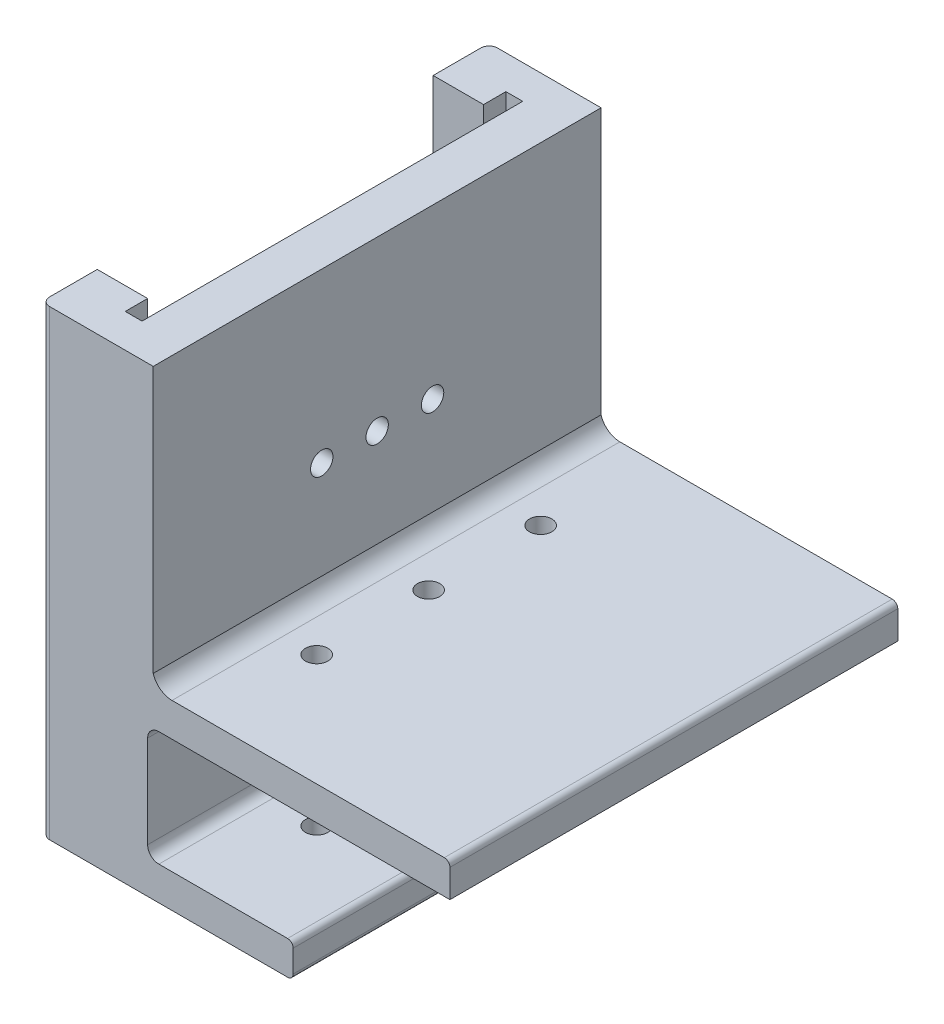
from build123d import *

# Parameters (mm, degrees)
BOSS_EXTRUDE2_DEPTH = 80
SKETCH3_R           = 2
CUT_EXTRUDE2_DEPTH  = 80
SKETCH4_W           = 20
SKETCH4_H           = 80
BOSS_EXTRUDE3_DEPTH = 50
BOSS_EXTRUDE4_DEPTH = 80
SKETCH6_W           = 12
SKETCH6_H           = 60
CUT_EXTRUDE4_DEPTH  = 90
SKETCH7_W           = 3
SKETCH7_H           = 68
CUT_EXTRUDE5_DEPTH  = 90
SKETCH9_R           = 2
CUT_EXTRUDE6_DEPTH  = 90
SKETCH11_R          = 2
CUT_EXTRUDE7_DEPTH  = 90


with BuildPart() as part:
    # Sketch1 → Boss-Extrude2 (new body)
    with BuildSketch(Plane.XY):
        with BuildLine():
            ThreePointArc((26, -15.25), (25.707106781, -15.957106781), (25, -16.25))
            Line((25, -16.25), (-19, -16.25))
            Line((-19, -16.25), (-19, 16.25))
            Line((-19, 16.25), (4, 16.25))
            Line((4, 16.25), (53, 16.25))
            ThreePointArc((53, 16.25), (53.707106781, 15.957106781), (54, 15.25))
            Line((54, 15.25), (54, 10.25))
            Line((54, 10.25), (2, 10.25))
            ThreePointArc((2, 10.25), (0.585786438, 9.664213562), (0, 8.25))
            Line((0, 8.25), (0, -8.25))
            ThreePointArc((0, -8.25), (0.585786438, -9.664213562), (2, -10.25))
            Line((2, -10.25), (25, -10.25))
            ThreePointArc((25, -10.25), (25.707106781, -10.542893219), (26, -11.25))
            Line((26, -11.25), (26, -15.25))
        make_face()
    extrude(amount=BOSS_EXTRUDE2_DEPTH)

    # Sketch3 → Cut-Extrude2 (cut)
    with BuildSketch(Plane(origin=(0, 16.25, 0), x_dir=(1, 0, 0), z_dir=(0, 1, 0))):
        with Locations(Location((10.2, -40, 0), (0, 0, 270))):
            Circle(SKETCH3_R)
        with Locations(Location((10.2, -60, 0), (0, 0, 270))):
            Circle(SKETCH3_R)
        with Locations(Location((10.2, -20, 0), (0, 0, 270))):
            Circle(SKETCH3_R)
    extrude(amount=-CUT_EXTRUDE2_DEPTH, mode=Mode.SUBTRACT)

    # Sketch4 → Boss-Extrude3 (add)
    with BuildSketch(Plane(origin=(0, 16.25, 0), x_dir=(1, 0, 0), z_dir=(0, 1, 0))):
        with Locations((-9, -40)):
            Rectangle(SKETCH4_W, SKETCH4_H)
    extrude(amount=BOSS_EXTRUDE3_DEPTH)

    # Sketch5 → Boss-Extrude4 (add)
    with BuildSketch(Plane.XY.offset(80)):
        with BuildLine():
            ThreePointArc((4.354101966, 16.25), (2.2624519, 16.94375696), (1, 18.75))
            Line((1, 18.75), (1, 16.25))
            Line((1, 16.25), (4.354101966, 16.25))
        make_face()
    extrude(amount=-BOSS_EXTRUDE4_DEPTH)

    # Sketch6 → Cut-Extrude4 (cut)
    with BuildSketch(Plane(origin=(0, 66.25, 0), x_dir=(1, 0, 0), z_dir=(0, 1, 0))):
        with Locations((-13, -40)):
            Rectangle(SKETCH6_W, SKETCH6_H)
        with BuildLine():
            ThreePointArc((-17.5, -80), (-18.560660172, -79.560660172), (-19, -78.5))
            Line((-19, -78.5), (-19, -80))
            Line((-19, -80), (-17.5, -80))
        make_face()
        with BuildLine():
            Line((-19, 0), (-19, -1.5))
            ThreePointArc((-19, -1.5), (-18.560660172, -0.439339828), (-17.5, 0))
            Line((-17.5, 0), (-19, 0))
        make_face()
    extrude(amount=-CUT_EXTRUDE4_DEPTH, mode=Mode.SUBTRACT)

    # Sketch7 → Cut-Extrude5 (cut)
    with BuildSketch(Plane(origin=(0, 66.25, 0), x_dir=(1, 0, 0), z_dir=(0, 1, 0))):
        with Locations((-8.5, -40)):
            Rectangle(SKETCH7_W, SKETCH7_H)
    extrude(amount=-CUT_EXTRUDE5_DEPTH, mode=Mode.SUBTRACT)

    # Sketch9 → Cut-Extrude6 (cut)
    with BuildSketch(Plane(origin=(1, 0, 0), x_dir=(0, 0, -1), z_dir=(1, 0, 0))):
        with Locations(Location((-49.9, 36.25, 0), (0, 0, 90))):
            Circle(SKETCH9_R)
        with Locations(Location((-30.1, 36.25, 0), (0, 0, 90))):
            Circle(SKETCH9_R)
    extrude(amount=-CUT_EXTRUDE6_DEPTH, mode=Mode.SUBTRACT)

    # Sketch11 → Cut-Extrude7 (cut)
    with BuildSketch(Plane(origin=(1, 0, 0), x_dir=(0, 0, -1), z_dir=(1, 0, 0))):
        with Locations(Location((-40, 36.25, 0), (0, 0, 90))):
            Circle(SKETCH11_R)
    extrude(amount=-CUT_EXTRUDE7_DEPTH, mode=Mode.SUBTRACT)


solid = part.part
